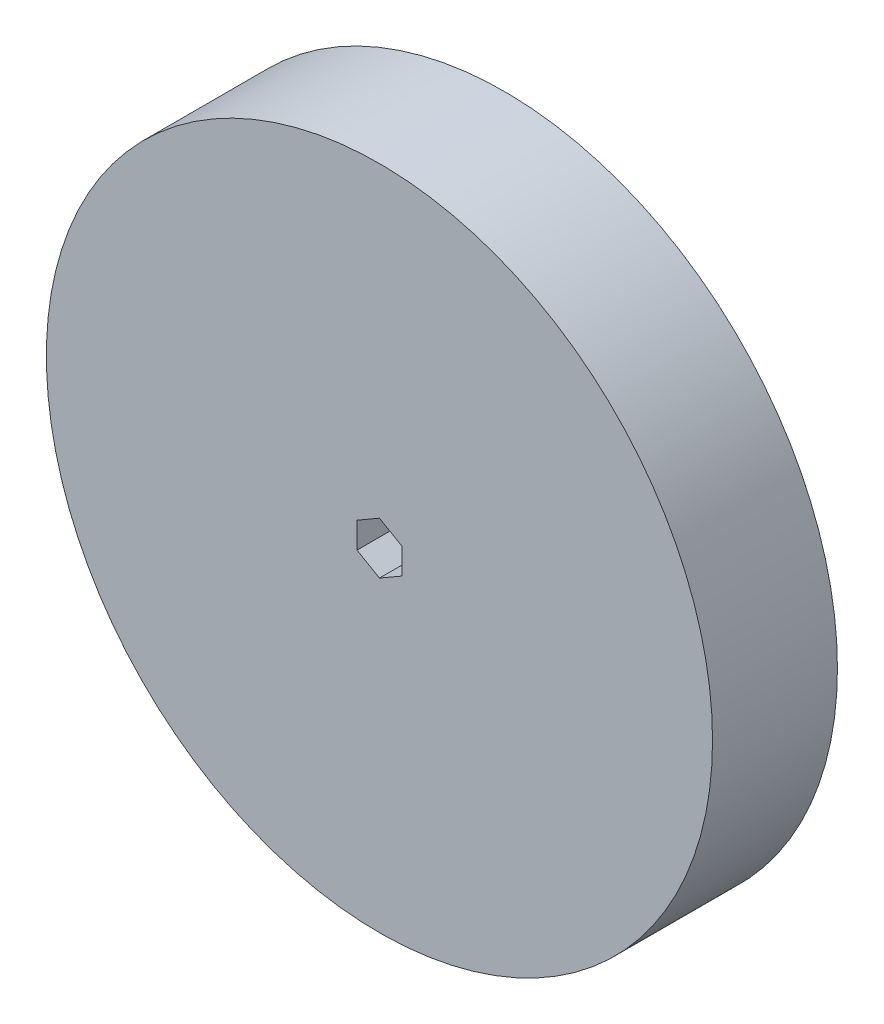
from build123d import *

# Parameters (mm, degrees)
SKETCH1_R           = 101.6
BOSS_EXTRUDE1_DEPTH = 38.1


with BuildPart() as part:
    # Sketch1 → Boss-Extrude1 (new body)
    with BuildSketch(Plane.XY):
        Circle(SKETCH1_R)
        Polygon((0, 7.909698688), (-6.85, 3.954849344), (-6.85, -3.954849344), (0, -7.909698688), (6.85, -3.954849344), (6.85, 3.954849344), align=None, mode=Mode.SUBTRACT)
    extrude(amount=-BOSS_EXTRUDE1_DEPTH)


solid = part.part
